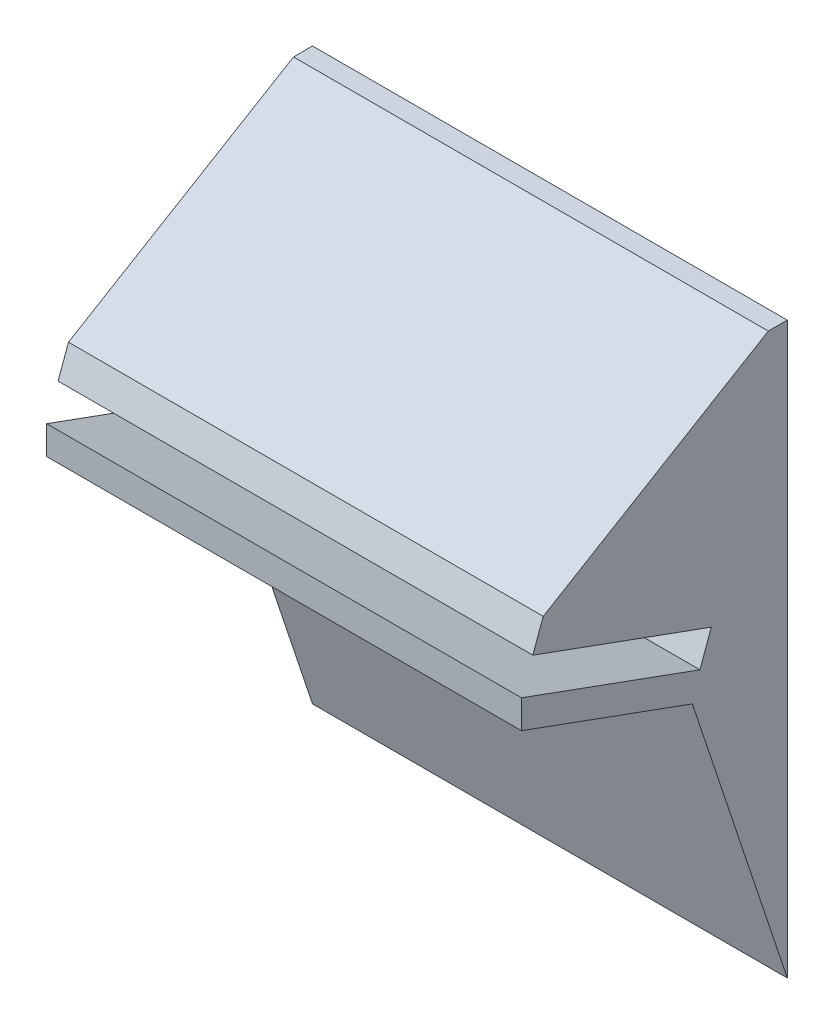
from build123d import *

# Parameters (mm, degrees)
ESQUISSE1_W        = 50
ESQUISSE1_H        = 30
BOSS_EXTRU_1_DEPTH = 2
BOSS_EXTRU_2_DEPTH = 50
BOSS_EXTRU_4_DEPTH = 50


with BuildPart() as part:
    # Esquisse1 → Boss.-Extru.1 (new body)
    with BuildSketch(Plane.XY):
        with Locations((25, 15)):
            Rectangle(ESQUISSE1_W, ESQUISSE1_H)
    extrude(amount=BOSS_EXTRU_1_DEPTH)

    # Esquisse2 → Boss.-Extru.2 (add)
    with BuildSketch(Plane(origin=(50, 0, 0), x_dir=(0, 0, -1), z_dir=(1, 0, 0))):
        Polygon((-2, 0), (-10, 0), (-27.990922917, 6.548160429), (-27.990922917, 9.548160429), (-9.197070502, 2.707757562), (-8, 5.996681735), (-26.793852416, 12.837084602), (-25.701941713, 15.837084602), (-2, 30), align=None)
    extrude(amount=-BOSS_EXTRU_2_DEPTH)

    # Esquisse4 → Boss.-Extru.4 (add)
    with BuildSketch(Plane(origin=(50, 0, 0), x_dir=(0, 0, -1), z_dir=(1, 0, 0))):
        Polygon((0, 0), (0, -30), (-10, 0), align=None)
    extrude(amount=-BOSS_EXTRU_4_DEPTH)


solid = part.part
